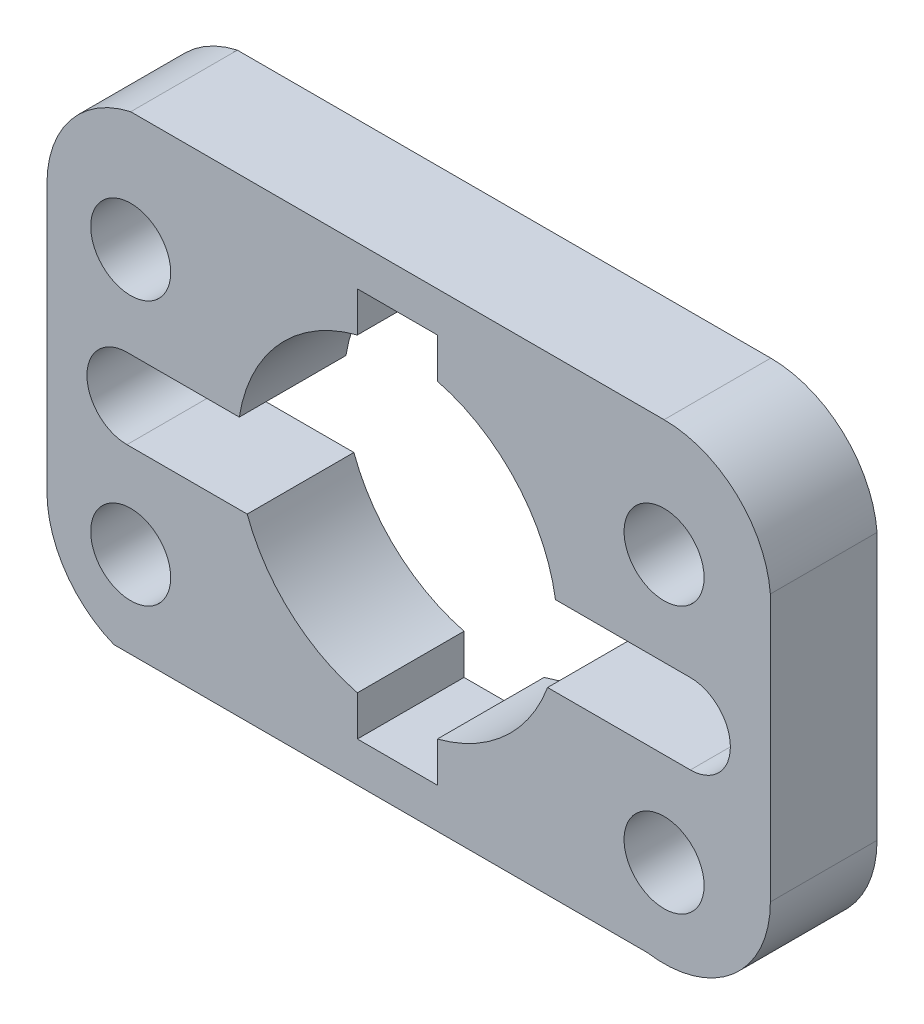
from build123d import *

# Parameters (mm, degrees)
SKETCH1_R           = 9.525
BOSS_EXTRUDE1_DEPTH = 25.4


with BuildPart() as part:
    # Sketch1 → Boss-Extrude1 (new body)
    with BuildSketch(Plane.XY):
        with BuildLine():
            Line((-3.995852665, -20.577576414), (123.004147335, -20.577576414))
            ThreePointArc((123.004147335, -20.577576414), (143.432942762, -14.772522971), (152.311571269, 4.520073639))
            Line((152.311571269, 4.520073639), (152.311571269, 68.020073639))
            ThreePointArc((152.311571269, 68.020073639), (144.195614803, 84.596871175), (126.99997378, 91.302756331))
            Line((126.99997378, 91.302756331), (-2.622e-05, 91.302756331))
            ThreePointArc((-2.622e-05, 91.302756331), (-14.336851136, 82.409941414), (-19.939739045, 66.496602579))
            Line((-19.939739045, 66.496602579), (-19.939739045, 2.996602579))
            ThreePointArc((-19.939739045, 2.996602579), (-15.579526187, -11.233202656), (-3.995852665, -20.577576414))
        make_face()
        Circle(SKETCH1_R, mode=Mode.SUBTRACT)
        with Locations((0.00144481, 62.909901332)):
            Circle(SKETCH1_R, mode=Mode.SUBTRACT)
        with Locations((127.000131197, 63.487530849)):
            Circle(SKETCH1_R, mode=Mode.SUBTRACT)
        with Locations((126.999999388, -0.01246915)):
            Circle(SKETCH1_R, mode=Mode.SUBTRACT)
        with BuildLine():
            Line((-0.889739045, 41.26253085), (25.859586911, 41.26253085))
            ThreePointArc((25.859586911, 41.26253085), (35.282229592, 60.962735138), (53.975, 72.252756331))
            Line((53.975, 72.252756331), (53.975, 81.777756331))
            Line((53.975, 81.777756331), (62.356166676, 81.777756331))
            Line((62.356166676, 81.777756331), (73.025, 81.777756331))
            Line((73.025, 81.777756331), (73.025, 72.252756331))
            ThreePointArc((73.025, 72.252756331), (91.717770408, 60.962735138), (101.140413089, 41.26253085))
            Line((101.140413089, 41.26253085), (133.261571269, 41.26253085))
            ThreePointArc((133.261571269, 41.26253085), (142.786571269, 31.73753085), (133.261571269, 22.21253085))
            Line((133.261571269, 22.21253085), (99.258718454, 22.21253085))
            ThreePointArc((99.258718454, 22.21253085), (89.064662377, 7.11266894), (73.025, -1.527576414))
            Line((73.025, -1.527576414), (73.025, -11.052576414))
            Line((73.025, -11.052576414), (62.799638263, -11.052576414))
            Line((62.799638263, -11.052576414), (53.975, -11.052576414))
            Line((53.975, -11.052576414), (53.975, -1.527576414))
            ThreePointArc((53.975, -1.527576414), (37.935337623, 7.11266894), (27.741281546, 22.21253085))
            Line((27.741281546, 22.21253085), (-0.889739045, 22.21253085))
            ThreePointArc((-0.889739045, 22.21253085), (-10.414739045, 31.73753085), (-0.889739045, 41.26253085))
        make_face(mode=Mode.SUBTRACT)
    extrude(amount=BOSS_EXTRUDE1_DEPTH)


solid = part.part
